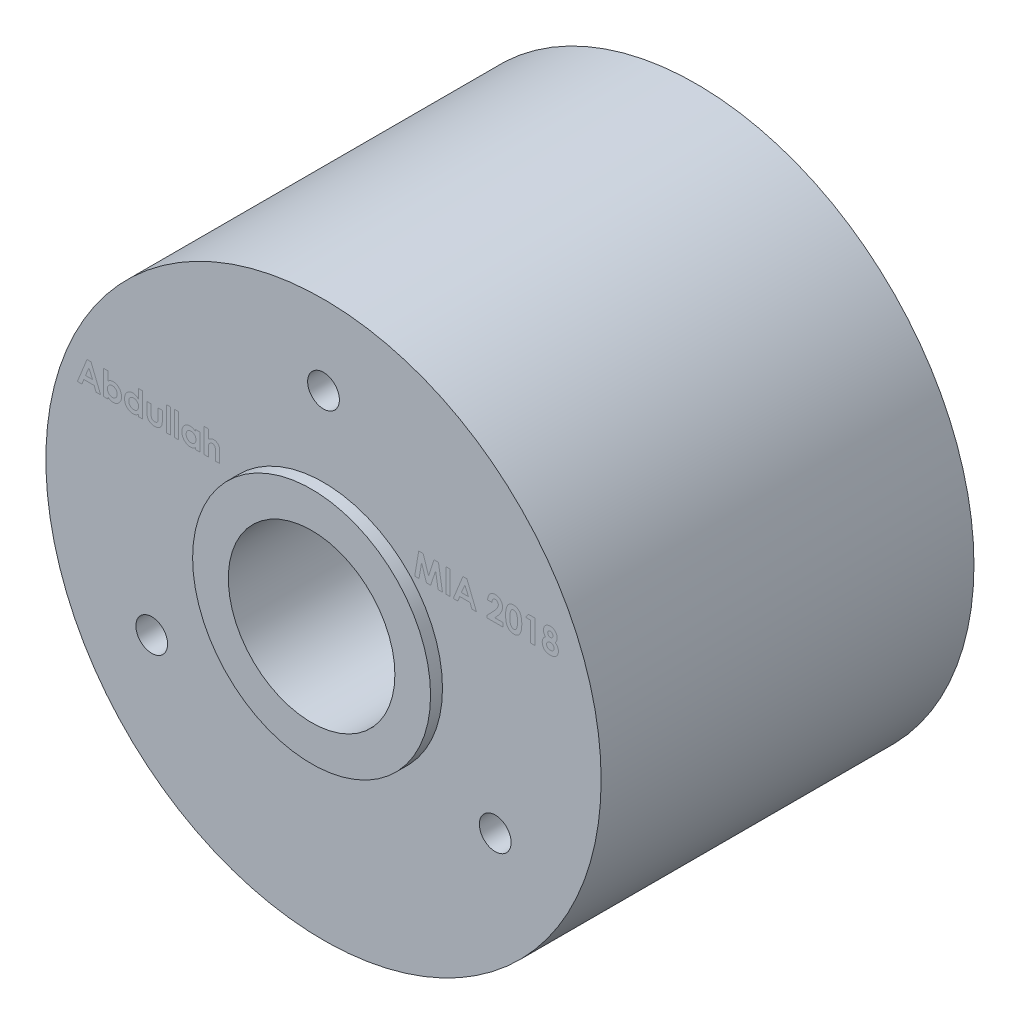
from build123d import *

# Parameters (mm, degrees)
SKETCH1_R           = 35
BOSS_EXTRUDE1_DEPTH = 23.5
SKETCH2_R           = 15
BOSS_EXTRUDE2_DEPTH = 25
CUT_EXTRUDE1_REACH  = 72.356
SKETCH3_R           = 10.5
CUT_EXTRUDE2_REACH  = 71.298
SKETCH4_R           = 2


with BuildPart() as part:
    # Sketch1 → Boss-Extrude1 (new, symmetric)
    with BuildSketch(Plane.XY):
        Circle(SKETCH1_R)
    extrude(amount=BOSS_EXTRUDE1_DEPTH, both=True)

    # Sketch2 → Boss-Extrude2 (add, symmetric)
    with BuildSketch(Plane.XY):
        Circle(SKETCH2_R)
    extrude(amount=BOSS_EXTRUDE2_DEPTH, both=True)

    # Sketch3 → Cut-Extrude1 (cut, up to next)
    with BuildSketch(Plane.XY.offset(25), mode=Mode.PRIVATE) as cut_extrude1_sk1:
        Circle(SKETCH3_R)
    cut_extrude1_tool1 = extrude(cut_extrude1_sk1.sketch, amount=-CUT_EXTRUDE1_REACH, mode=Mode.PRIVATE) & part.part
    add(cut_extrude1_tool1.solids().sort_by_distance((0, 0, 25))[0], mode=Mode.SUBTRACT)

    # Sketch4 → Cut-Extrude2 (cut, up to next)
    with BuildSketch(Plane.XY.offset(23.5), mode=Mode.PRIVATE) as cut_extrude2_sk1:
        with Locations((0, 25)):
            Circle(SKETCH4_R)
    cut_extrude2_tool1 = extrude(cut_extrude2_sk1.sketch, amount=-CUT_EXTRUDE2_REACH, mode=Mode.PRIVATE) & part.part
    # Sketch4 → Cut-Extrude2 (cut, up to next)
    with BuildSketch(Plane.XY.offset(23.5), mode=Mode.PRIVATE) as cut_extrude2_sk2:
        with Locations((21.650635095, -12.5)):
            Circle(SKETCH4_R)
    cut_extrude2_tool2 = extrude(cut_extrude2_sk2.sketch, amount=-CUT_EXTRUDE2_REACH, mode=Mode.PRIVATE) & part.part
    # Sketch4 → Cut-Extrude2 (cut, up to next)
    with BuildSketch(Plane.XY.offset(23.5), mode=Mode.PRIVATE) as cut_extrude2_sk3:
        with Locations((-21.650635095, -12.5)):
            Circle(SKETCH4_R)
    cut_extrude2_tool3 = extrude(cut_extrude2_sk3.sketch, amount=-CUT_EXTRUDE2_REACH, mode=Mode.PRIVATE) & part.part
    add(cut_extrude2_tool1.solids().sort_by_distance((0, 25, 23.5))[0], mode=Mode.SUBTRACT)
    add(cut_extrude2_tool2.solids().sort_by_distance((21.650635, -12.5, 23.5))[0], mode=Mode.SUBTRACT)
    add(cut_extrude2_tool3.solids().sort_by_distance((-21.650635, -12.5, 23.5))[0], mode=Mode.SUBTRACT)


solid = part.part
